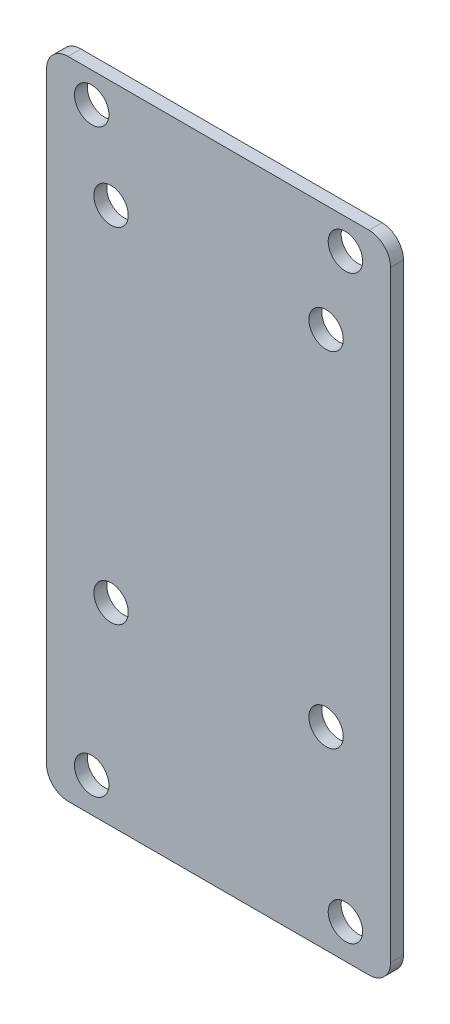
from build123d import *

# Parameters (mm, degrees)
SKETCH1_W           = 80
SKETCH1_H           = 150
SKETCH1_R           = 4
BOSS_EXTRUDE1_DEPTH = 3
FILLET3_R           = 5


with BuildPart() as part:
    # Sketch1 → Boss-Extrude1 (new body)
    with BuildSketch(Plane.XY):
        Rectangle(SKETCH1_W, SKETCH1_H)
        with Locations((-29.5, 68)):
            Circle(SKETCH1_R, mode=Mode.SUBTRACT)
        with Locations((29.5, 68)):
            Circle(SKETCH1_R, mode=Mode.SUBTRACT)
        with Locations((29.5, -67)):
            Circle(SKETCH1_R, mode=Mode.SUBTRACT)
        with Locations((-29.5, -67)):
            Circle(SKETCH1_R, mode=Mode.SUBTRACT)
        with Locations((-25, 50)):
            Circle(SKETCH1_R, mode=Mode.SUBTRACT)
        with Locations((25, 50)):
            Circle(SKETCH1_R, mode=Mode.SUBTRACT)
        with Locations((25, -30)):
            Circle(SKETCH1_R, mode=Mode.SUBTRACT)
        with Locations((-25, -30)):
            Circle(SKETCH1_R, mode=Mode.SUBTRACT)
    extrude(amount=BOSS_EXTRUDE1_DEPTH)

    # Fillet3
    fillet3_edges = [part.edges().sort_by_distance(p)[0] for p in [
        (40, -75, 1.5),
        (-40, -75, 1.5),
        (-40, 75, 1.5),
        (40, 75, 1.5),
    ]]
    fillet(fillet3_edges, radius=FILLET3_R)


solid = part.part
